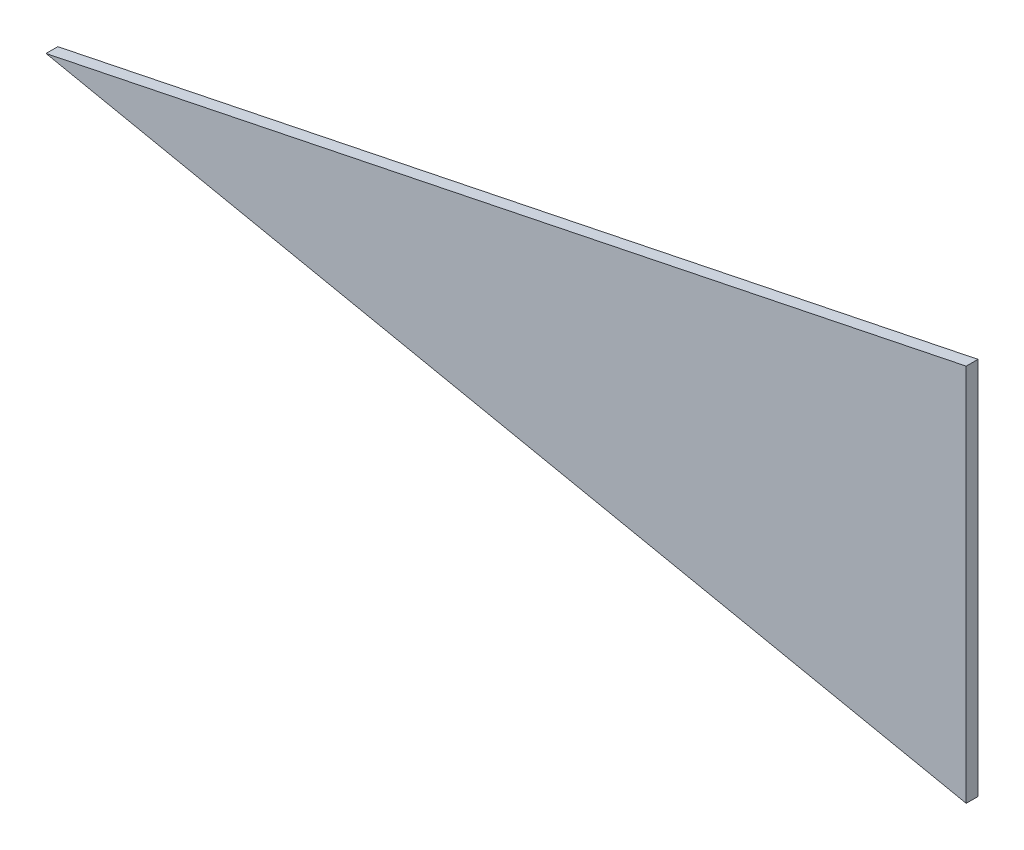
from build123d import *

# Parameters (mm, degrees)
BOSS_EXTRUDE1_DEPTH = 15


with BuildPart() as part:
    # Sketch1 → Boss-Extrude1 (new body)
    with BuildSketch(Plane.XY):
        Polygon((613.321633918, 152.1394463), (613.321633918, -328.793058883), (-555.45482201, -88.326806291), align=None)
    extrude(amount=BOSS_EXTRUDE1_DEPTH)


solid = part.part
